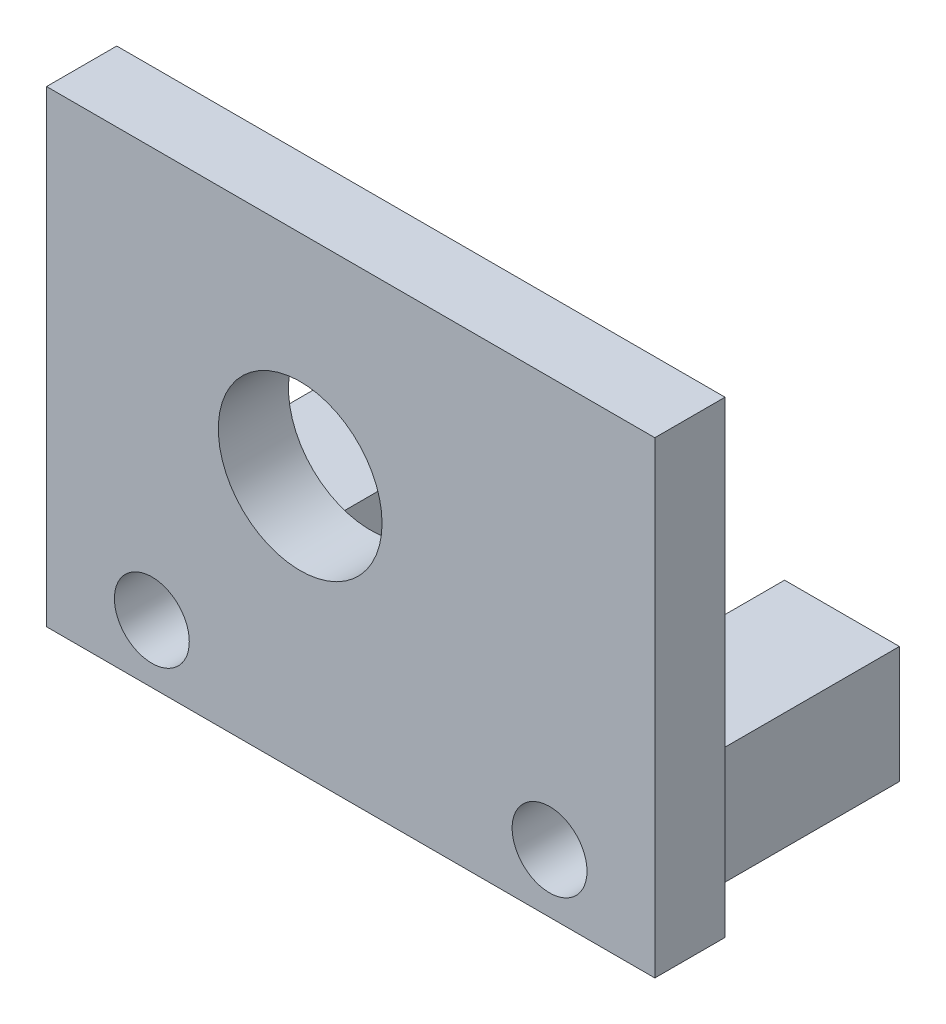
from build123d import *

# Parameters (mm, degrees)
SKETCH1_W           = 26
SKETCH1_H           = 20
SKETCH1_R           = 3.5
SKETCH1_R_2         = 1.6
BOSS_EXTRUDE1_DEPTH = 3
BOSS_EXTRUDE2_START = -9.5
SKETCH2_W           = 5.129495452
SKETCH2_H           = 5
SKETCH2_R           = 1.6
SKETCH2_W_2         = 4.90914111
BOSS_EXTRUDE2_DEPTH = 9.5


with BuildPart() as part:
    # Sketch1 → Boss-Extrude1 (new body)
    with BuildSketch(Plane.XY):
        with Locations((2.16, -1)):
            Rectangle(SKETCH1_W, SKETCH1_H)
        Circle(SKETCH1_R, mode=Mode.SUBTRACT)
        with Locations((-6.34, -8.5)):
            Circle(SKETCH1_R_2, mode=Mode.SUBTRACT)
        with Locations((10.66, -8.5)):
            Circle(SKETCH1_R_2, mode=Mode.SUBTRACT)
    extrude(amount=BOSS_EXTRUDE1_DEPTH)

    # Sketch2 → Boss-Extrude2 (add)
    # profile 1 of 2: a face of its own
    with BuildSketch(Plane.XY.offset(BOSS_EXTRUDE2_START)):
        with Locations((-6.34, -8.5)):
            Rectangle(SKETCH2_W, SKETCH2_H)
        with Locations((-6.34, -8.5)):
            Circle(SKETCH2_R, mode=Mode.SUBTRACT)
    # profile 2 of 2: a face of its own
    with BuildSketch(Plane.XY.offset(BOSS_EXTRUDE2_START)):
        with Locations((10.66, -8.5)):
            Rectangle(SKETCH2_W_2, SKETCH2_H)
        with Locations((10.66, -8.5)):
            Circle(SKETCH2_R, mode=Mode.SUBTRACT)
    extrude(amount=BOSS_EXTRUDE2_DEPTH)


solid = part.part
